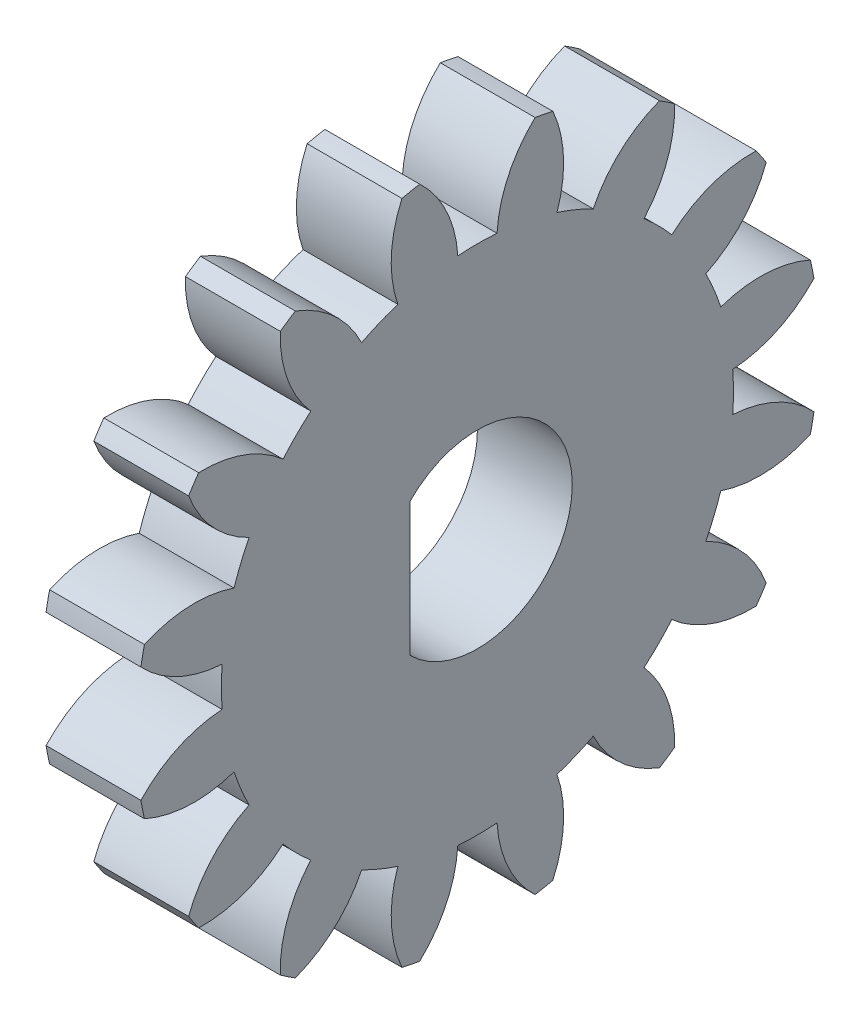
from build123d import *

# Parameters (mm, degrees)
BASPROSKE_W     = 5
BASPROSKE_H     = 18
TOOTHCUT_DEPTH  = 26.942243542
TEETHCUTS_COUNT = 16
TEETHCUTS_ANGLE = 337.5
BORSKE_R        = 5
BORE_DEPTH      = 50.0000508
EXTRUDE_START   = -5
EXTRUDE_1_DEPTH = 5


with BuildPart() as part:
    # BasProSke → Base-Revolve (revolve)
    with BuildSketch(Plane(origin=(0, 0, 0), x_dir=(1, 0, 0), z_dir=(0, 1, 0)), mode=Mode.PRIVATE) as base_revolve_sk:
        with Locations((2.5, 9)):
            Rectangle(BASPROSKE_W, BASPROSKE_H)
    revolve(base_revolve_sk.sketch.rotate(Axis((-10, 0, 0), (1, 0, 0)), 180), axis=Axis((-10, 0, 0), (1, 0, 0)))

    # TooCutSke → ToothCut (cut, through all)
    with BuildSketch(Plane(origin=(0, 0, 0), x_dir=(0, 0, -1), z_dir=(1, 0, 0))):
        with BuildLine():
            ThreePointArc((1.03434411, 13.459313997), (0, 13.499), (-1.03434411, 13.459313997))
            ThreePointArc((-1.03434411, 13.459313997), (-1.635143665, 15.806872195), (-3.065655864, 17.762792553))
            ThreePointArc((-3.065655864, 17.762792553), (0, 18.0254), (3.065655864, 17.762792553))
            ThreePointArc((3.065655864, 17.762792553), (1.635143665, 15.806872195), (1.03434411, 13.459313997))
        make_face()
    toothcut = extrude(amount=TOOTHCUT_DEPTH, mode=Mode.SUBTRACT)

    # TeethCuts: ToothCut ×16 about axis
    teethcuts_axis = Axis((-10, 0, 0), (1, 0, 0))
    for i in range(1, TEETHCUTS_COUNT):
        add(toothcut.rotate(teethcuts_axis, i * TEETHCUTS_ANGLE / (TEETHCUTS_COUNT - 1)), mode=Mode.SUBTRACT)

    # BorSke → Bore (cut, symmetric)
    with BuildSketch(Plane(origin=(0, 0, 0), x_dir=(0, 0, -1), z_dir=(1, 0, 0))):
        with Locations(Location((0, 0, 0), (0, 0, 180))):
            Circle(BORSKE_R)
    extrude(amount=BORE_DEPTH, both=True, mode=Mode.SUBTRACT)

    # 草图2 → 凸台-拉伸1 (add)
    with BuildSketch(Plane.ZY.offset(EXTRUDE_START)):
        with BuildLine():
            Line((3.544820497, 3.526222858), (3.544820497, -3.526222858))
            ThreePointArc((3.544820497, -3.526222858), (5, 0), (3.544820497, 3.526222858))
        make_face()
    extrude(amount=EXTRUDE_1_DEPTH)


solid = part.part
